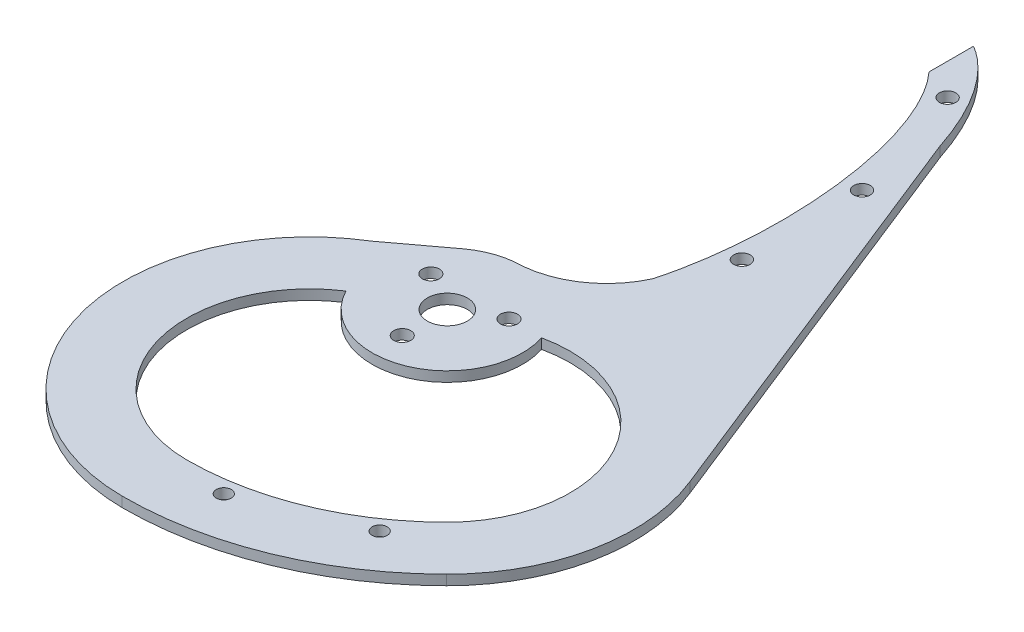
from build123d import *

# Parameters (mm, degrees)
SKETCH_1_R          = 1.5
SKETCH_1_R_2        = 4
SKETCH_1_R_3        = 1.7
EXTRUDE_1_DEPTH     = 2
SKETCH_2_R          = 1.65
CUT_EXTRUDE_1_DEPTH = 114.211457996


with BuildPart() as part:
    # Эскиз1 → Бобышка-Вытянуть1 (new body)
    with BuildSketch(Plane(origin=(0, 0, 0), x_dir=(1, 0, 0), z_dir=(0, 1, 0))):
        with BuildLine():
            Line((53.958573959, -5.561349479), (20.929615764, 77.346018647))
            add(Edge.make_bspline(
                [(20.929615764, 77.346018647), (15.874013102, 92.823492357), (7, 98)],
                knots=[5.291070227, 5.291070227, 5.291070227, 5.999391198, 5.999391198, 5.999391198], degree=2, weights=[1, 0.937937966, 1]))
            Line((7, 98), (7, 89.125236548))
            add(Edge.make_bspline(
                [(15.192612979, 25.829512169), (26.645146253, 67.955139718), (7, 89.125236548)],
                knots=[4.109476107, 4.109476107, 4.109476107, 5.848164932, 5.848164932, 5.848164932], degree=2, weights=[1, 0.645327493, 1]))
            ThreePointArc((15.192612979, 25.829512169), (9.04718601, 18.379331895), (0, 15))
            ThreePointArc((0, 15), (-4.727432256, 14.235567578), (-8.97302418, 12.020184569))
            Line((-8.97302418, 12.020184569), (-19.356829743, 4.268711381))
            ThreePointArc((-19.356829743, 4.268711381), (-35.846538498, -37.448042935), (-0.216613019, -64.70068493))
            ThreePointArc((-0.216613019, -64.70068493), (24.602337984, -59.841043752), (45.662397444, -45.83853195))
            ThreePointArc((45.662397444, -45.83853195), (55.881669425, -26.950465422), (53.958573959, -5.561349479))
        make_face()
        with Locations(Location((9.550649772, -54.164426416, 0), (0, 0, 270))):
            Circle(SKETCH_1_R, mode=Mode.SUBTRACT)
        with Locations(Location((31.546703999, -45.053362436, 0), (0, 0, 90))):
            Circle(SKETCH_1_R, mode=Mode.SUBTRACT)
        with Locations(Location((0, 0, 0), (0, 0, 270))):
            Circle(SKETCH_1_R_2, mode=Mode.SUBTRACT)
        with Locations(Location((0, -9, 0), (0, 0, 270))):
            Circle(SKETCH_1_R_3, mode=Mode.SUBTRACT)
        with Locations(Location((-7.794228634, 4.5, 0), (0, 0, 270))):
            Circle(SKETCH_1_R_3, mode=Mode.SUBTRACT)
        with Locations(Location((7.794228634, 4.5, 0), (0, 0, 270))):
            Circle(SKETCH_1_R_3, mode=Mode.SUBTRACT)
        with BuildLine():
            ThreePointArc((0, -52), (19.899538483, -48.041735691), (36.769552622, -36.769552622))
            ThreePointArc((36.769552622, -36.769552622), (40.965347854, -7.734611808), (14.306107991, 4.50946495))
            ThreePointArc((14.306107991, 4.50946495), (10.606601718, -10.606601718), (-4.50946495, -14.306107991))
            ThreePointArc((-4.50946495, -14.306107991), (-9.64091288, -11.491422838), (-13.304619219, -6.927272727))
            ThreePointArc((-13.304619219, -6.927272727), (-23.497678802, -34.43607172), (0, -52))
        make_face(mode=Mode.SUBTRACT)
    extrude(amount=EXTRUDE_1_DEPTH)

    # Эскиз2 → Вырез-Вытянуть1 (cut, through all)
    with BuildSketch(Plane.XZ):
        with Locations(Location((20.772601242, -38.006933081, 0), (0, 0, 270))):
            Circle(SKETCH_2_R)
        with Locations(Location((13.298587158, -86.537567928, 0), (0, 0, 270))):
            Circle(SKETCH_2_R)
        with Locations(Location((20.772601242, -61.993066919, 0), (0, 0, 270))):
            Circle(SKETCH_2_R)
    extrude(amount=-CUT_EXTRUDE_1_DEPTH, mode=Mode.SUBTRACT)


solid = part.part
